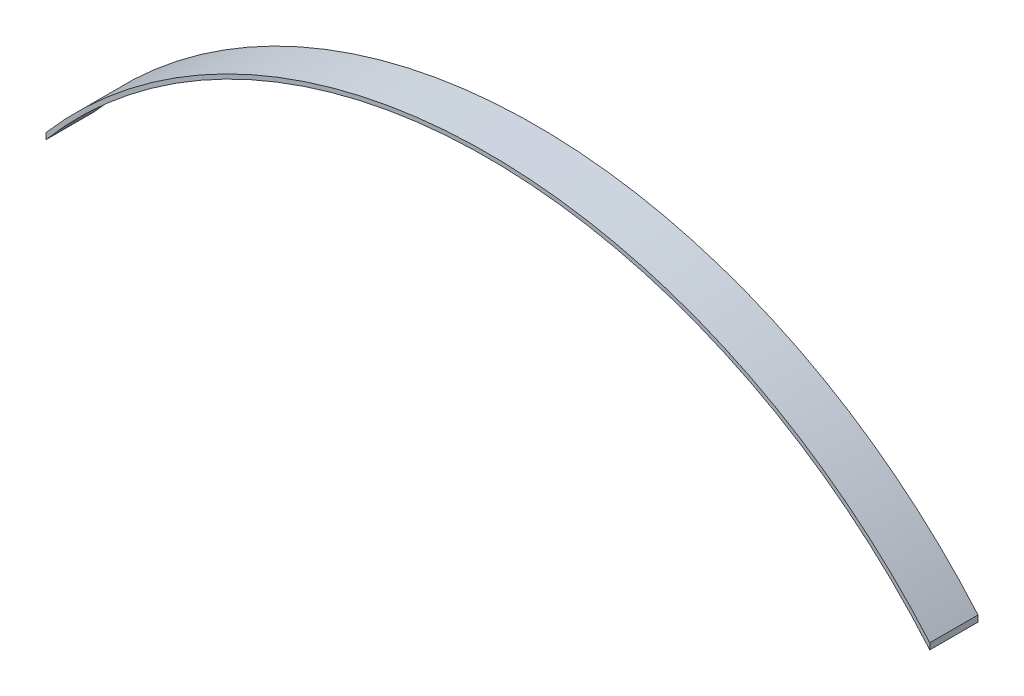
from build123d import *

# Parameters (mm, degrees)
BOSS_EXTRU_1_DEPTH = 12


with BuildPart() as part:
    # Esquisse2 → Boss.-Extru.1 (new body)
    with BuildSketch(Plane.XY):
        with BuildLine():
            Line((-110, 94.472218138), (-110, 92.930081244))
            ThreePointArc((-110, 92.930081244), (0, 144), (110, 92.930081244))
            Line((110, 92.930081244), (110, 94.472218138))
            ThreePointArc((110, 94.472218138), (0, 145), (-110, 94.472218138))
        make_face()
    extrude(amount=BOSS_EXTRU_1_DEPTH)


solid = part.part
